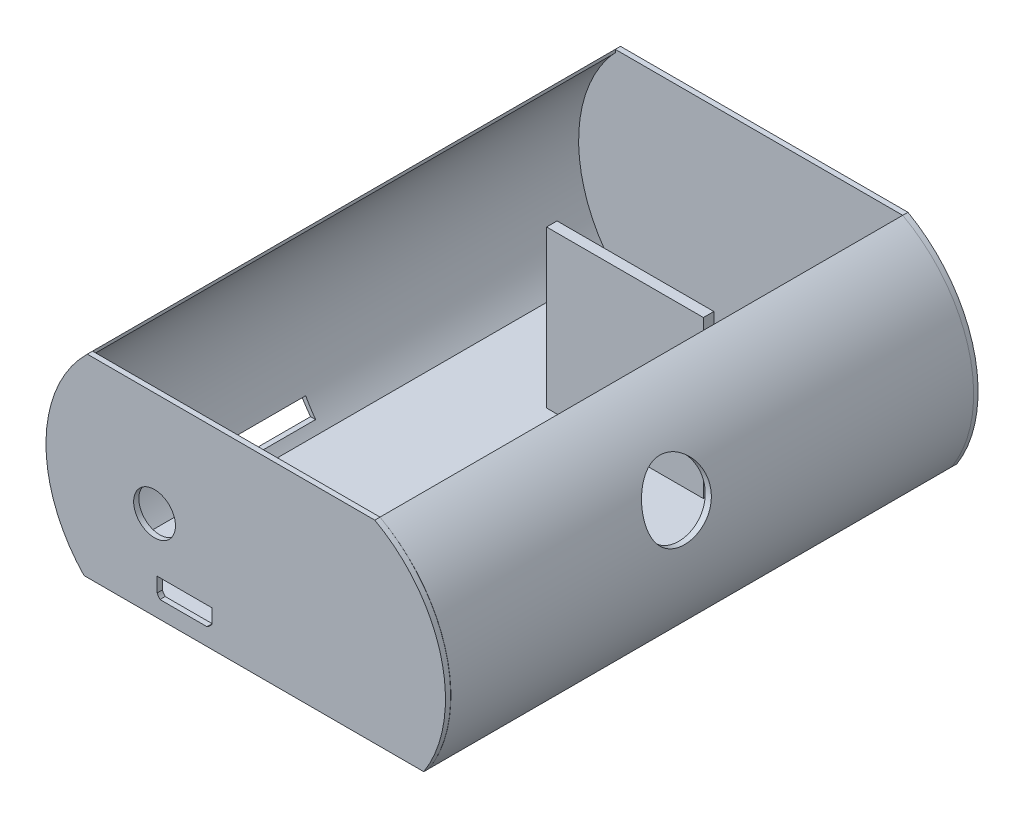
from build123d import *

# Parameters (mm, degrees)
BOSS_EXTRUDE6_DEPTH      = 100
BOSS_EXTRUDE6_DEPTH_BACK = 0.001
SKETCH19_R               = 6.25
SIDE_BUTTON_DEPTH        = 10
SKETCH21_W               = 13
SKETCH21_H               = 3
SD_DEPTH                 = 10
SKETCH_5_W               = 55
SKETCH_5_H               = 100.001
CUT_EXTRUDE_4_DEPTH      = 7
SKETCH_4_R               = 4
PORTS_DEPTH              = 1
TOP_COVER_DEPTH          = 1
SKETCH_7_W               = 30
SKETCH_7_H               = 2
EXTRUDE_5_DEPTH          = 30


with BuildPart() as part:
    # Sketch11 → Boss-Extrude6 (new, two sides: drawn at the far end of the back side and taken through both)
    with BuildSketch(Plane.XY.offset(-BOSS_EXTRUDE6_DEPTH_BACK)):
        with BuildLine():
            Line((-50.925767273, 31.436762529), (4.074232727, 31.436762529))
            ThreePointArc((4.074232727, 31.436762529), (16.843059589, 14.983457432), (13.439015431, -5.563237471))
            Line((13.439015431, -5.563237471), (-51.560984569, -5.563237471))
            ThreePointArc((-51.560984569, -5.563237471), (-58.976171577, 13.069519435), (-50.925767273, 31.436762529))
        make_face()
        with BuildLine():
            Line((-51.012961367, 30.835508878), (3.987038633, 30.835508878))
            ThreePointArc((3.987038633, 30.835508878), (15.684365135, 14.996890968), (13.439015431, -4.564491122))
            Line((13.439015431, -4.564491122), (-51.560984569, -4.564491122))
            ThreePointArc((-51.560984569, -4.564491122), (-57.931377732, 13.23837012), (-51.012961367, 30.835508878))
        make_face(mode=Mode.SUBTRACT)
    extrude(amount=BOSS_EXTRUDE6_DEPTH + BOSS_EXTRUDE6_DEPTH_BACK)

    # Sketch19 → side button (cut)
    with BuildSketch(Plane(origin=(17.637860169, 0, 0), x_dir=(0, 0, -1), z_dir=(1, 0, 0))):
        with Locations(Location((-55.2, 17.436762529, 0), (0, 0, 90))):
            Circle(SKETCH19_R)
    extrude(amount=-SIDE_BUTTON_DEPTH, mode=Mode.SUBTRACT)

    # Sketch21 → sd (cut)
    with BuildSketch(Plane.ZY.offset(58.980002369)):
        with Locations((62, -1.563237471)):
            Rectangle(SKETCH21_W, SKETCH21_H)
    extrude(amount=-SD_DEPTH, mode=Mode.SUBTRACT)

    # 草图5 → 切除-拉伸4 (cut)
    with BuildSketch(Plane(origin=(0, 31.436762529, 0), x_dir=(1, 0, 0), z_dir=(0, 1, 0))):
        with Locations((-23.425767273, -49.9995)):
            Rectangle(SKETCH_5_W, SKETCH_5_H)
    extrude(amount=-CUT_EXTRUDE_4_DEPTH, mode=Mode.SUBTRACT)

    # 草图4 → ports (add)
    with BuildSketch(Plane.XY.offset(100)):
        with BuildLine():
            Line((-50.925767273, 31.436762529), (4.074232727, 31.436762529))
            ThreePointArc((4.074232727, 31.436762529), (16.797971673, 14.972045579), (13.439015431, -5.563237471))
            Line((13.439015431, -5.563237471), (-51.560984569, -5.563237471))
            ThreePointArc((-51.560984569, -5.563237471), (-58.825710556, 13.066936315), (-50.925767273, 31.436762529))
        make_face()
        with Locations((-38.060984569, 11.436762529)):
            Circle(SKETCH_4_R, mode=Mode.SUBTRACT)
        with BuildLine():
            Line((-37.560984569, 1.332835104), (-27.101744103, 1.332835104))
            Line((-27.101744103, 1.332835104), (-27.101744103, -1.446793765))
            ThreePointArc((-27.101744103, -1.446793765), (-27.522930097, -1.907180738), (-28.029632197, -2.271332887))
            Line((-28.029632197, -2.271332887), (-37.028696773, -2.271332887))
            ThreePointArc((-37.028696773, -2.271332887), (-37.327749623, -1.880307962), (-37.560984569, -1.446793765))
            Line((-37.560984569, -1.446793765), (-37.560984569, 1.332835104))
        make_face(mode=Mode.SUBTRACT)
    extrude(amount=PORTS_DEPTH)

    # 草图6 → top cover (add)
    with BuildSketch(Plane(origin=(0, 0, -0.001), x_dir=(-1, 0, 0), z_dir=(0, 0, -1))):
        with BuildLine():
            Line((-4.074232727, 31.436762529), (50.925767273, 31.436762529))
            ThreePointArc((50.925767273, 31.436762529), (58.934474425, 13.068803577), (51.560984569, -5.563237471))
            Line((51.560984569, -5.563237471), (-13.439015431, -5.563237471))
            ThreePointArc((-13.439015431, -5.563237471), (-16.680513275, 14.942316596), (-4.074232727, 31.436762529))
        make_face()
    extrude(amount=TOP_COVER_DEPTH)

    # 草图7 → 凸台-拉伸5 (add)
    with BuildSketch(Plane(origin=(0, -4.564491122, 0), x_dir=(1, 0, 0), z_dir=(0, 1, 0))):
        with Locations((-19.060984569, -29)):
            Rectangle(SKETCH_7_W, SKETCH_7_H)
    extrude(amount=EXTRUDE_5_DEPTH)


solid = part.part
